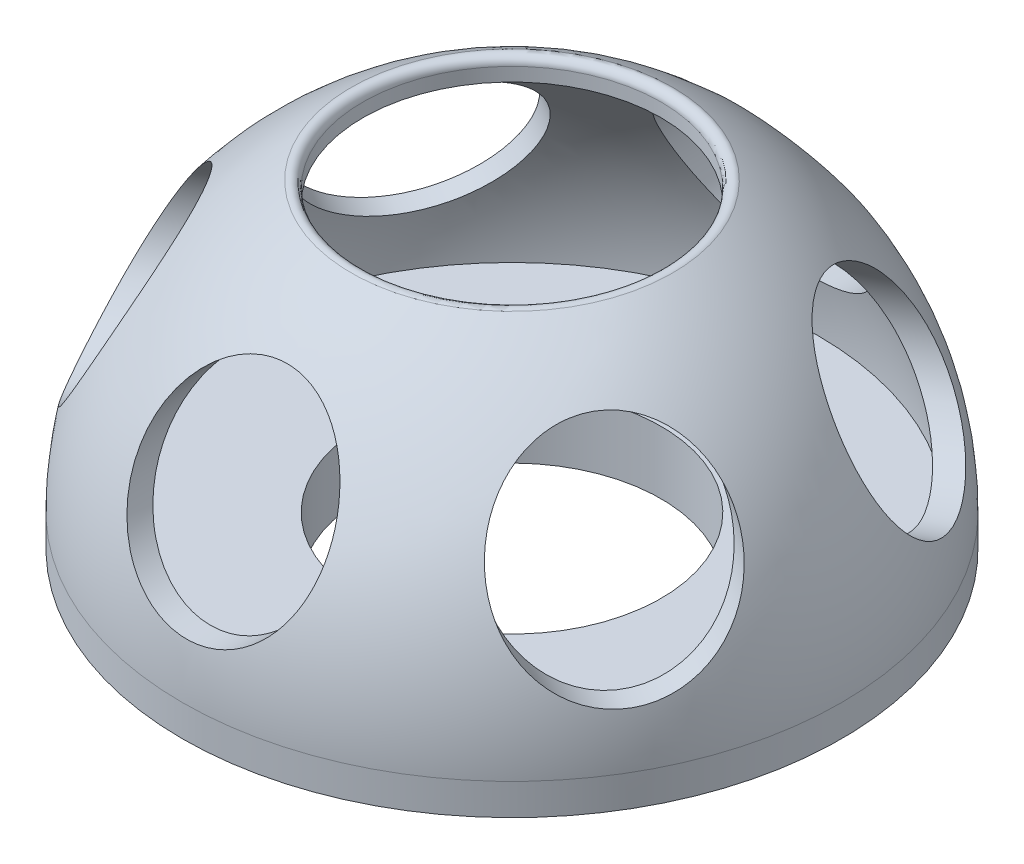
from build123d import *

# Parameters (mm, degrees)
SKETCH1_R           = 11
SKETCH1_R_2         = 9.5
BOSS_EXTRUDE1_DEPTH = 2
BOSS_EXTRUDE2_START = 2
SKETCH2_R           = 21
SKETCH2_R_2         = 9.5
BOSS_EXTRUDE2_DEPTH = 2
REVOLVE1_ANGLE      = 180
SKETCH4_R           = 9.5
CUT_EXTRUDE1_DEPTH  = 39.820097888
SKETCH5_R           = 6
CUT_EXTRUDE2_DEPTH  = 38.39754766
CIRPATTERN1_COUNT   = 3
FILLET1_R           = 0.5


with BuildPart() as part:
    # Sketch1 → Boss-Extrude1 (new body)
    with BuildSketch(Plane(origin=(0, 2, 0), x_dir=(1, 0, 0), z_dir=(0, 1, 0))):
        with Locations(Location((0, 0, 0), (0, 0, 270))):
            Circle(SKETCH1_R)
        with Locations(Location((0, 0, 0), (0, 0, 270))):
            Circle(SKETCH1_R_2, mode=Mode.SUBTRACT)
    extrude(amount=-BOSS_EXTRUDE1_DEPTH)

    # Sketch2 → Boss-Extrude2 (add)
    with BuildSketch(Plane(origin=(0, 2, 0), x_dir=(1, 0, 0), z_dir=(0, 1, 0)).offset(BOSS_EXTRUDE2_START)):
        with Locations(Location((0, 0, 0), (0, 0, 270))):
            Circle(SKETCH2_R)
        with Locations(Location((0, 0, 0), (0, 0, 270))):
            Circle(SKETCH2_R_2, mode=Mode.SUBTRACT)
    extrude(amount=-BOSS_EXTRUDE2_DEPTH)

    # Sketch3 → Revolve1 (revolve)
    with BuildSketch(Plane(origin=(0, 4, 0), x_dir=(1, 0, 0), z_dir=(0, 1, 0))):
        with BuildLine():
            Line((-19.5, 0), (-21, 0))
            ThreePointArc((-21, 0), (0, 21), (21, 0))
            Line((21, 0), (19.5, 0))
            ThreePointArc((19.5, 0), (0, 19.5), (-19.5, 0))
        make_face()
    revolve(axis=Axis((-19.5, 4, 0), (1, 0, 0)), revolution_arc=REVOLVE1_ANGLE)

    # Sketch4 → Cut-Extrude1 (cut, through all)
    with BuildSketch(Plane.XZ):
        with Locations(Location((0, 0, 0), (0, 0, 90))):
            Circle(SKETCH4_R)
    extrude(amount=-CUT_EXTRUDE1_DEPTH, mode=Mode.SUBTRACT)

    # Sketch5 → Cut-Extrude2 (cut, symmetric)
    with BuildSketch(Plane.XY):
        with Locations(Location((0, 13.3641604, 0), (0, 0, 220.958797012))):
            Circle(SKETCH5_R)
    cut_extrude2 = extrude(amount=CUT_EXTRUDE2_DEPTH, both=True, mode=Mode.SUBTRACT)

    # CirPattern1: Cut-Extrude2 ×3 about axis
    cirpattern1_axis = Axis((0, 22.7283208, 0), (0, -1, 0))
    for i in range(1, CIRPATTERN1_COUNT):
        add(cut_extrude2.rotate(cirpattern1_axis, i * 360 / CIRPATTERN1_COUNT), mode=Mode.SUBTRACT)

    # Fillet1
    fillet1_edges = [part.edges().sort_by_distance(p)[0] for p in [
        (0, 22.7283208, -9.5),
    ]]
    fillet(fillet1_edges, radius=FILLET1_R)


solid = part.part
